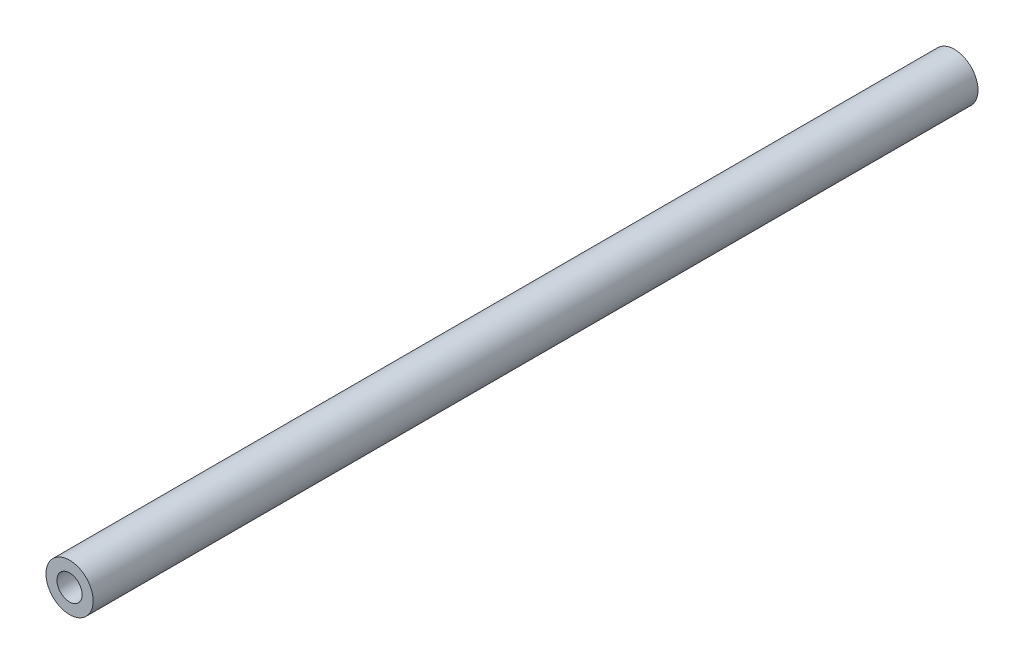
from build123d import *

# Parameters (mm, degrees)
SCHIZZO1_R                   = 6
ESTRUSIONE_ESTRUSIONE1_DEPTH = 112.5


with BuildPart() as part:
    # Schizzo1 → Estrusione-Estrusione1 (new, symmetric)
    with BuildSketch(Plane.XY):
        Circle(SCHIZZO1_R)
    extrude(amount=ESTRUSIONE_ESTRUSIONE1_DEPTH, both=True)

    # Schizzo3 → Foro per Vite M6-1 (revolve, cut)
    with BuildSketch(Plane(origin=(0, 0, 112.5), x_dir=(0, -1, 0), z_dir=(1, 0, 0))):
        Polygon((0, 0), (0, 25), (3.2, 23.077246019), (3.2, 0), align=None)
    foro_per_vite_m6_1 = revolve(axis=Axis((0, 0, 118.85), (0, 0, -1)), mode=Mode.SUBTRACT)

    # Specchia1: Foro per Vite M6-1 across plane
    add(foro_per_vite_m6_1.mirror(Plane.XY), mode=Mode.SUBTRACT)


solid = part.part
